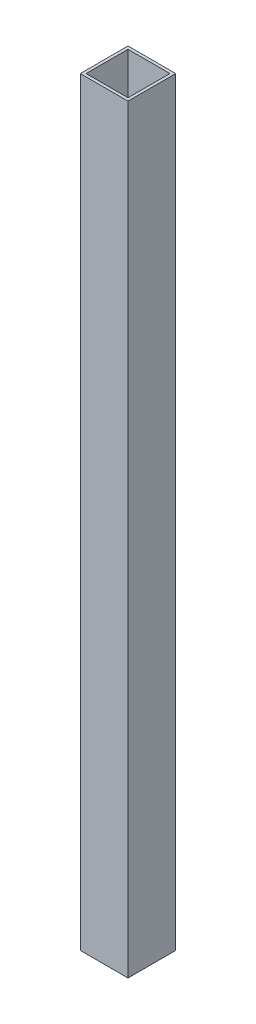
from build123d import *

# Parameters (mm, degrees)
SKETCH1_W           = 25
SKETCH1_H           = 25
SKETCH1_W_2         = 22
SKETCH1_H_2         = 22
EXTRUDE_THIN1_DEPTH = 199


with BuildPart() as part:
    # Sketch1 → Extrude-Thin1 (new, symmetric)
    with BuildSketch(Plane(origin=(0, 0, 0), x_dir=(1, 0, 0), z_dir=(0, 1, 0))):
        Rectangle(SKETCH1_W, SKETCH1_H)
        Rectangle(SKETCH1_W_2, SKETCH1_H_2, mode=Mode.SUBTRACT)
    extrude(amount=EXTRUDE_THIN1_DEPTH, both=True)


solid = part.part
